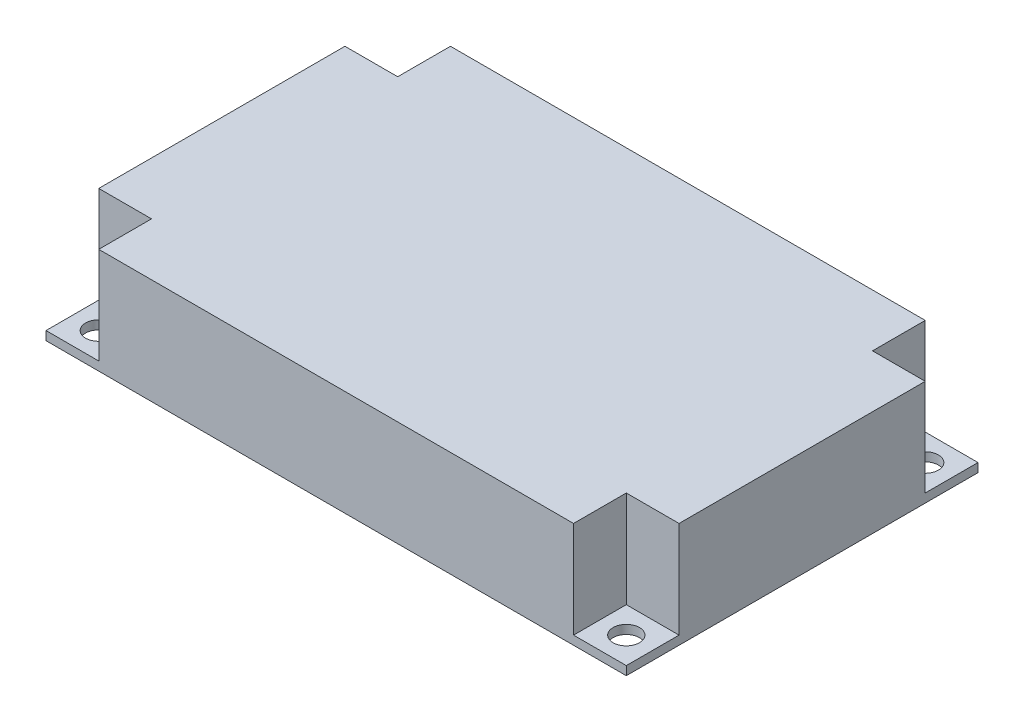
from build123d import *

# Parameters (mm, degrees)
SKETCH_1_W          = 66
SKETCH_1_H          = 40
EXTRUDE_1_DEPTH     = 12
SKETCH_2_R          = 1.5
CUT_EXTRUDE_1_DEPTH = 41.410394702
SKETCH_3_W          = 6
SKETCH_3_H          = 6
CUT_EXTRUDE_2_DEPTH = 11


with BuildPart() as part:
    # 草图1 → 凸台-拉伸1 (new body)
    with BuildSketch(Plane(origin=(0, 0, 0), x_dir=(1, 0, 0), z_dir=(0, 1, 0))):
        Rectangle(SKETCH_1_W, SKETCH_1_H)
    extrude(amount=EXTRUDE_1_DEPTH)

    # 草图2 → 切除-拉伸1 (cut, through all)
    with BuildSketch(Plane(origin=(0, 12, 0), x_dir=(1, 0, 0), z_dir=(0, 1, 0))):
        with Locations(Location((-30, -17, 0), (0, 0, 270))):
            Circle(SKETCH_2_R)
        with Locations(Location((30, -17, 0), (0, 0, 90))):
            Circle(SKETCH_2_R)
        with Locations(Location((30, 17, 0), (0, 0, 270))):
            Circle(SKETCH_2_R)
        with Locations(Location((-30, 17, 0), (0, 0, 90))):
            Circle(SKETCH_2_R)
    extrude(amount=-CUT_EXTRUDE_1_DEPTH, mode=Mode.SUBTRACT)

    # 草图3 → 切除-拉伸2 (cut)
    with BuildSketch(Plane(origin=(0, 12, 0), x_dir=(1, 0, 0), z_dir=(0, 1, 0))):
        with Locations((-30, 17)):
            Rectangle(SKETCH_3_W, SKETCH_3_H)
        with Locations((30, 17)):
            Rectangle(SKETCH_3_W, SKETCH_3_H)
        with Locations((30, -17)):
            Rectangle(SKETCH_3_W, SKETCH_3_H)
        with Locations((-30, -17)):
            Rectangle(SKETCH_3_W, SKETCH_3_H)
    extrude(amount=-CUT_EXTRUDE_2_DEPTH, mode=Mode.SUBTRACT)


solid = part.part
